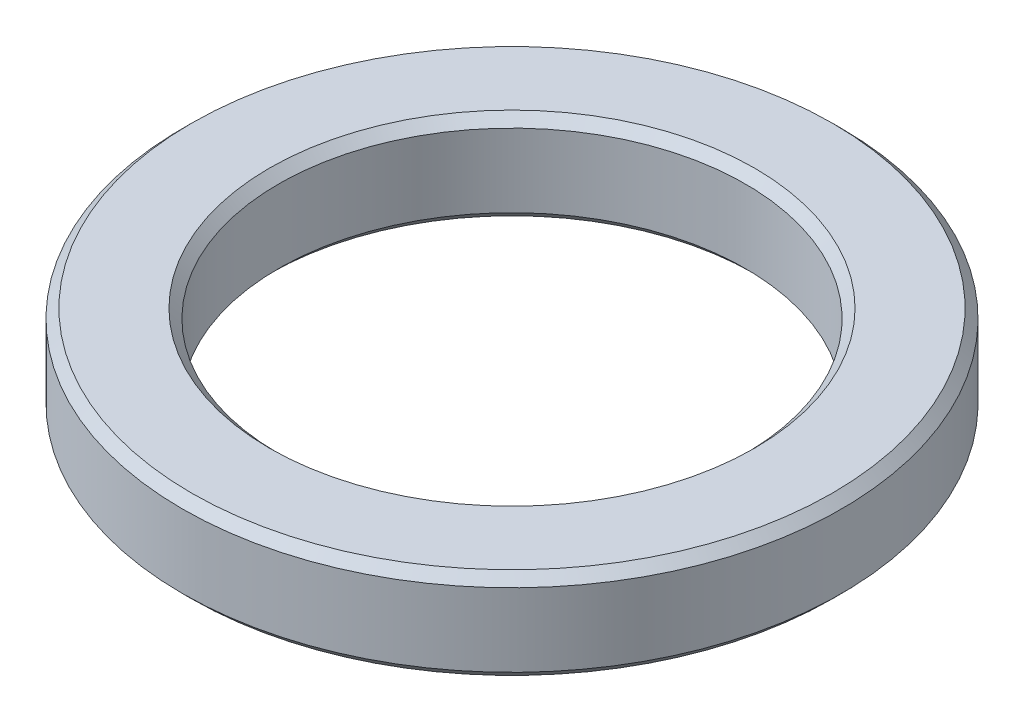
from build123d import *

# Parameters (mm, degrees)
SKETCH_1_R      = 18
SKETCH_1_R_2    = 12.75
EXTRUDE_1_DEPTH = 5
CHAMFER_1_SIZE  = 0.5


with BuildPart() as part:
    # 草图1 → 凸台-拉伸1 (new body)
    with BuildSketch(Plane(origin=(0, 0, 0), x_dir=(1, 0, 0), z_dir=(0, 1, 0))):
        with Locations(Location((0, 0, 0), (0, 0, 270))):
            Circle(SKETCH_1_R)
        with Locations(Location((0, 0, 0), (0, 0, 270))):
            Circle(SKETCH_1_R_2, mode=Mode.SUBTRACT)
    extrude(amount=EXTRUDE_1_DEPTH)

    # 倒角1
    chamfer_1_edges = [part.edges().sort_by_distance(p)[0] for p in [
        (0, 0, -18),
        (0, 5, -18),
        (0, 0, -12.75),
        (0, 5, -12.75),
    ]]
    chamfer(chamfer_1_edges, length=CHAMFER_1_SIZE)


solid = part.part
